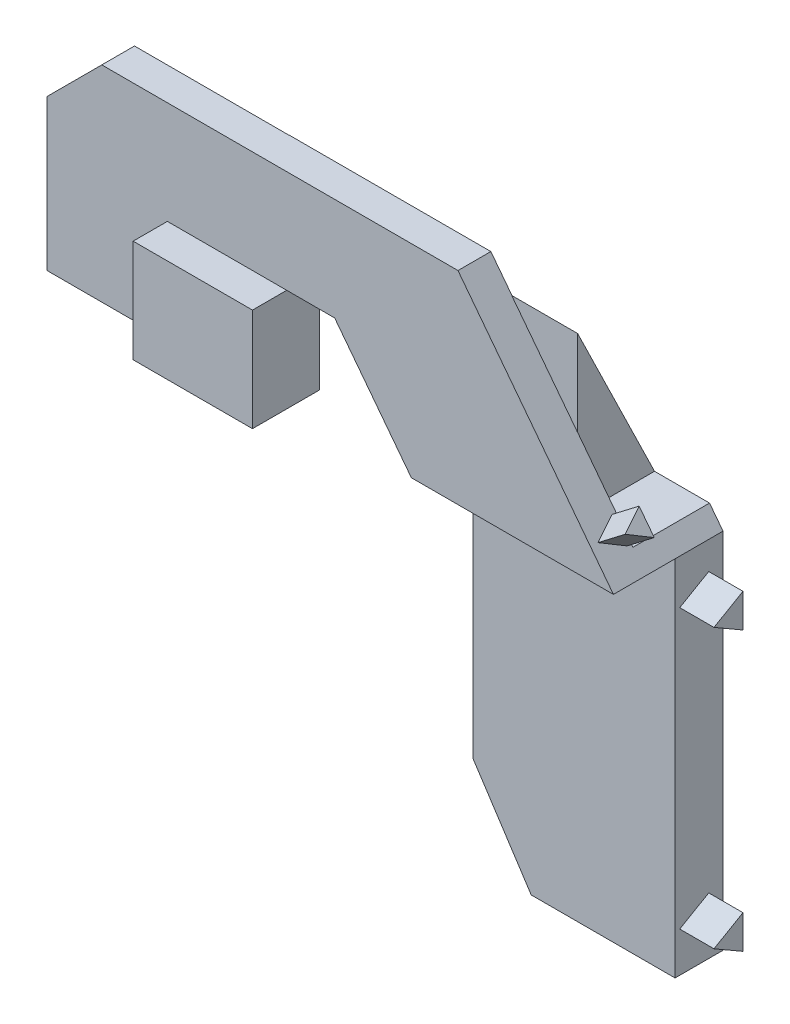
from build123d import *

# Parameters (mm, degrees)
Y_KSEKLIK_EKSTR_ZYON1_DEPTH  = 7
Y_KSEKLIK_EKSTR_ZYON3_DEPTH  = 16
IZIM4_W                      = 28.954743141
IZIM4_H                      = 11.22646766
KES_EKSTR_ZYON1_DEPTH        = 46
IZIM5_W                      = 11.030629952
IZIM5_H                      = 8.549284238
KES_EKSTR_ZYON2_DEPTH        = 46
IZIM6_W                      = 6.045256859
IZIM6_H                      = 10.292433703
KES_EKSTR_ZYON3_DEPTH        = 46
IZIM7_W                      = 3.22646766
IZIM7_H                      = 15.019672312
KES_EKSTR_ZYON5_DEPTH        = 10
IZIM9_W                      = 11.22646766
IZIM9_H                      = 15
KES_EKSTR_ZYON6_DEPTH        = 50
KES_EKSTR_ZYON9_DEPTH        = 11.2
Y_KSEKLIK_EKSTR_ZYON4_DEPTH  = 5
Y_KSEKLIK_EKSTR_ZYON7_DEPTH  = 5
IZIM17_W                     = 17.426851058
IZIM17_H                     = 15
Y_KSEKLIK_EKSTR_ZYON8_DEPTH  = 5
Y_KSEKLIK_EKSTR_ZYON18_DEPTH = 0.028
Y_KSEKLIK_EKSTR_ZYON20_START = -10
Y_KSEKLIK_EKSTR_ZYON20_DEPTH = 20


with BuildPart() as part:
    # Çizim1 → Yükseklik-Ekstrüzyon1 (new body)
    with BuildSketch(Plane.XY):
        Polygon((42, 15), (53.195140403, 0.397642952), (82.695140403, 0.397642952), (60, 30), (8, 30), (0, 22), (0, 0), (35, 0), (35, 15), align=None)
        Polygon((61.695140403, -52.602357048), (53.195140403, -39.602357048), (53.195140403, 0.397642952), (82.695140403, 0.397642952), (82.695140403, -52.602357048), align=None)
    extrude(amount=Y_KSEKLIK_EKSTR_ZYON1_DEPTH)

    # Çizim2 → Yükseklik-Ekstrüzyon3 (add)
    with BuildSketch(Plane(origin=(0, 0, 0), x_dir=(-1, 0, 0), z_dir=(0, 0, -1))):
        Polygon((-53.195140403, 0.397642952), (-82.695140403, 0.397642952), (-60, 30), (-8, 30), (0, 22), (0, 0), (-35, 0), (-35, 15), (-42, 15), align=None)
    extrude(amount=-Y_KSEKLIK_EKSTR_ZYON3_DEPTH)

    # Çizim4 → Kes-Ekstrüzyon1 (cut)
    with BuildSketch(Plane.XZ):
        with Locations((20.522628429, 5.61323383)):
            Rectangle(IZIM4_W, IZIM4_H)
    extrude(amount=-KES_EKSTR_ZYON1_DEPTH, mode=Mode.SUBTRACT)

    # Çizim5 → Kes-Ekstrüzyon2 (cut)
    with BuildSketch(Plane(origin=(-11, 11, 0), x_dir=(0, 0, 1), z_dir=(-0.7071067811865477, 0.7071067811865475, 0))):
        with Locations((5.711152684, 19.830991305)):
            Rectangle(IZIM5_W, IZIM5_H)
    extrude(amount=-KES_EKSTR_ZYON2_DEPTH, mode=Mode.SUBTRACT)

    # Çizim6 → Kes-Ekstrüzyon3 (cut)
    with BuildSketch(Plane.XZ):
        with Locations((3.02262843, 2.853783148)):
            Rectangle(IZIM6_W, IZIM6_H)
    extrude(amount=-KES_EKSTR_ZYON3_DEPTH, mode=Mode.SUBTRACT)

    # Çizim7 → Kes-Ekstrüzyon5 (cut)
    with BuildSketch(Plane.ZY):
        with Locations((9.61323383, 14.490163844)):
            Rectangle(IZIM7_W, IZIM7_H)
    extrude(amount=-KES_EKSTR_ZYON5_DEPTH, mode=Mode.SUBTRACT)

    # Çizim9 → Kes-Ekstrüzyon6 (cut)
    with BuildSketch(Plane.ZY.offset(-35)):
        with Locations((5.61323383, 22.5)):
            Rectangle(IZIM9_W, IZIM9_H)
    extrude(amount=-KES_EKSTR_ZYON6_DEPTH, mode=Mode.SUBTRACT)

    # Çizim11 → Kes-Ekstrüzyon9 (cut)
    with BuildSketch(Plane(origin=(0, 0, 0), x_dir=(-1, 0, 0), z_dir=(0, 0, -1))):
        Polygon((-80.727385525, 2.96427975), (-71.5, 15), (-42, 15), (-51.227385525, 2.96427975), align=None)
    extrude(amount=-KES_EKSTR_ZYON9_DEPTH, mode=Mode.SUBTRACT)

    # Çizim14 → Yükseklik-Ekstrüzyon4 (add)
    with BuildSketch(Plane(origin=(82.695140403, 0, 0), x_dir=(0, 0, -1), z_dir=(1, 0, 0))):
        Polygon((-2.082581095, -49.195758149), (-2.082581095, -44.303374806), (-6.319509355, -46.749566478), align=None)
        Polygon((-2.082581095, -3.669592505), (-6.319509355, -6.115784177), (-2.082581095, -8.561975848), align=None)
    extrude(amount=Y_KSEKLIK_EKSTR_ZYON4_DEPTH)

    # Çizim15 → Yükseklik-Ekstrüzyon7 (add)
    with BuildSketch(Plane(origin=(52.274317705, 40.076976907, 0), x_dir=(0, 0, -1), z_dir=(0.7936063612919158, 0.6084315436571359, 0))):
        Polygon((-14.921026004, -44.527343425), (-11.781107025, -46.340176493), (-11.781107025, -42.714510357), align=None)
    extrude(amount=Y_KSEKLIK_EKSTR_ZYON7_DEPTH)

    # Çizim17 → Yükseklik-Ekstrüzyon8 (add)
    with BuildSketch(Plane.XY.offset(16)):
        with Locations((26.286574471, 7.5)):
            Rectangle(IZIM17_W, IZIM17_H)
    extrude(amount=Y_KSEKLIK_EKSTR_ZYON8_DEPTH)

    # Çizim21 → Yükseklik-Ekstrüzyon18 (add)
    with BuildSketch(Plane(origin=(0, 0, 11.22646766), x_dir=(-1, 0, 0), z_dir=(0, 0, -1))):
        Polygon((-42, 15), (-71.5, 15), (-60, 30), (-30.5, 30), align=None)
    extrude(amount=Y_KSEKLIK_EKSTR_ZYON18_DEPTH)

    # Çizim18 → Yükseklik-Ekstrüzyon20 (add)
    with BuildSketch(Plane(origin=(82.695140403, 0, 0), x_dir=(0, 0, -1), z_dir=(1, 0, 0)).offset(Y_KSEKLIK_EKSTR_ZYON20_START)):
        Polygon((0, 2.96427975), (-11.22646766, 26), (-11.2, 2.96427975), align=None)
    extrude(amount=-Y_KSEKLIK_EKSTR_ZYON20_DEPTH)


solid = part.part
